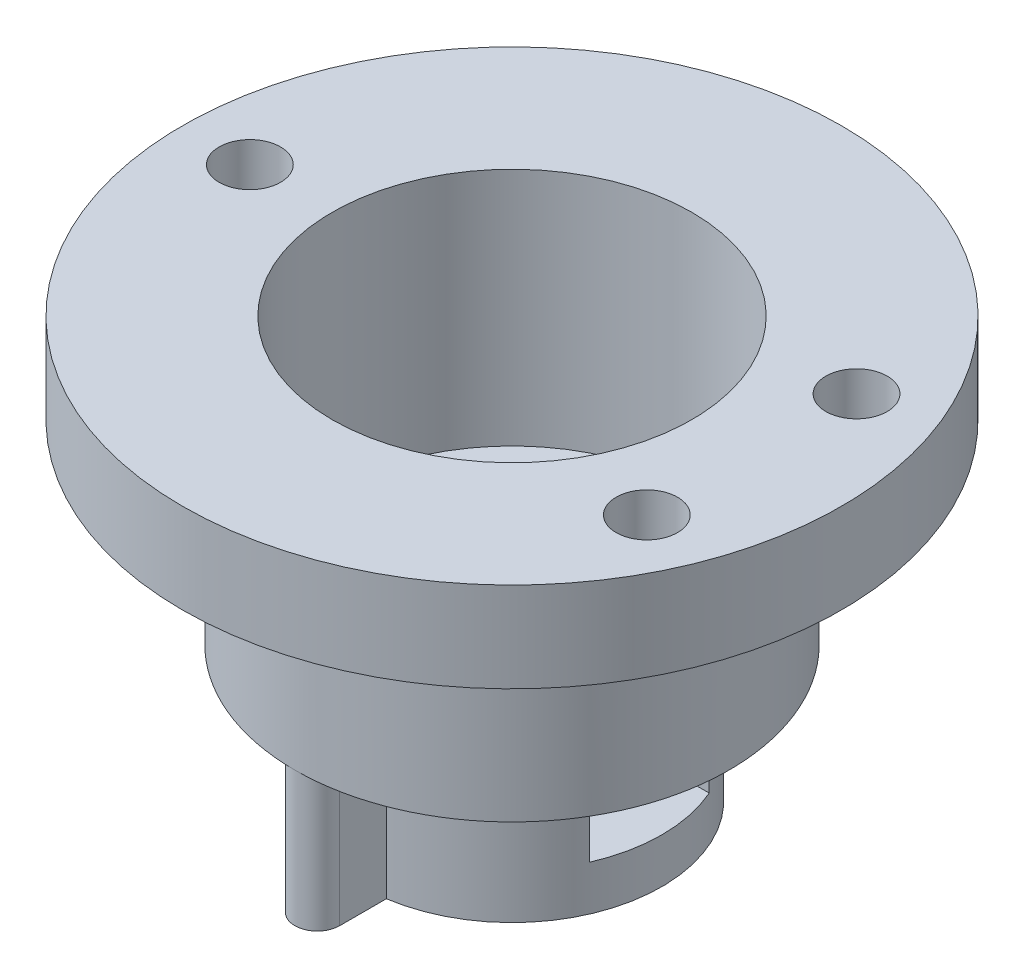
from build123d import *

# Parameters (mm, degrees)
CROQUIS5_R              = 10
SALIENTE_EXTRUIR1_DEPTH = 9
CROQUIS6_R              = 14.5
SALIENTE_EXTRUIR2_DEPTH = 13
CROQUIS7_R              = 22
SALIENTE_EXTRUIR3_DEPTH = 6
CROQUIS8_R              = 12
CORTAR_EXTRUIR1_DEPTH   = 16
CROQUIS9_R              = 3
CORTAR_EXTRUIR2_DEPTH   = 16
CROQUIS10_W             = 3
CROQUIS10_H             = 9
SALIENTE_EXTRUIR4_DEPTH = 13
SALIENTE_EXTRUIR5_DEPTH = 13
CROQUIS12_W             = 8
CROQUIS12_H             = 3.8
CORTAR_EXTRUIR3_DEPTH   = 13
CROQUIS13_R             = 3
CORTAR_EXTRUIR4_DEPTH   = 13
CROQUIS14_R             = 2.05
CORTAR_EXTRUIR5_DEPTH   = 13


with BuildPart() as part:
    # Croquis5 → Saliente-Extruir1 (new body)
    with BuildSketch(Plane(origin=(0, 0, 0), x_dir=(1, 0, 0), z_dir=(0, 1, 0))):
        with Locations(Location((0, 0, 0), (0, 0, 270))):
            Circle(CROQUIS5_R)
    extrude(amount=SALIENTE_EXTRUIR1_DEPTH)

    # Croquis6 → Saliente-Extruir2 (add)
    with BuildSketch(Plane(origin=(0, 9, 0), x_dir=(1, 0, 0), z_dir=(0, 1, 0))):
        with Locations(Location((0, 0, 0), (0, 0, 90))):
            Circle(CROQUIS6_R)
    extrude(amount=SALIENTE_EXTRUIR2_DEPTH)

    # Croquis7 → Saliente-Extruir3 (add)
    with BuildSketch(Plane(origin=(0, 22, 0), x_dir=(1, 0, 0), z_dir=(0, 1, 0))):
        with Locations(Location((0, 0, 0), (0, 0, 270))):
            Circle(CROQUIS7_R)
    extrude(amount=SALIENTE_EXTRUIR3_DEPTH)

    # Croquis8 → Cortar-Extruir1 (cut)
    with BuildSketch(Plane(origin=(0, 28, 0), x_dir=(1, 0, 0), z_dir=(0, 1, 0))):
        with Locations(Location((0, 0, 0), (0, 0, 270))):
            Circle(CROQUIS8_R)
    extrude(amount=-CORTAR_EXTRUIR1_DEPTH, mode=Mode.SUBTRACT)

    # Croquis9 → Cortar-Extruir2 (cut)
    with BuildSketch(Plane(origin=(0, 12, 0), x_dir=(1, 0, 0), z_dir=(0, 1, 0))):
        with Locations(Location((0, 0, 0), (0, 0, 270))):
            Circle(CROQUIS9_R)
    extrude(amount=-CORTAR_EXTRUIR2_DEPTH, mode=Mode.SUBTRACT)

    # Croquis10 → Saliente-Extruir4 (add)
    with BuildSketch(Plane.XY):
        with Locations((0, 4.5)):
            Rectangle(CROQUIS10_W, CROQUIS10_H)
    extrude(amount=SALIENTE_EXTRUIR4_DEPTH)

    # Croquis11 → Saliente-Extruir5 (add)
    with BuildSketch(Plane.XZ):
        with BuildLine():
            Line((-1.5, 13), (1.5, 13))
            ThreePointArc((1.5, 13), (0, 14.5), (-1.5, 13))
        make_face()
    extrude(amount=-SALIENTE_EXTRUIR5_DEPTH)

    # Croquis12 → Cortar-Extruir3 (cut)
    with BuildSketch(Plane(origin=(0, 0, 0), x_dir=(0, 0, -1), z_dir=(1, 0, 0))):
        with Locations((0, 4.9)):
            Rectangle(CROQUIS12_W, CROQUIS12_H)
    extrude(amount=CORTAR_EXTRUIR3_DEPTH, mode=Mode.SUBTRACT)

    # Croquis13 → Cortar-Extruir4 (cut)
    with BuildSketch(Plane(origin=(0, 12, 0), x_dir=(1, 0, 0), z_dir=(0, 1, 0))):
        with Locations(Location((0, 0, 0), (0, 0, 270))):
            Circle(CROQUIS13_R)
    extrude(amount=-CORTAR_EXTRUIR4_DEPTH, mode=Mode.SUBTRACT)

    # Croquis14 → Cortar-Extruir5 (cut)
    with BuildSketch(Plane(origin=(0, 28, 0), x_dir=(1, 0, 0), z_dir=(0, 1, 0))):
        with Locations(Location((-17.5, 0, 0), (0, 0, 270))):
            Circle(CROQUIS14_R)
        with Locations(Location((15.999727998, 7, 0), (0, 0, 270))):
            Circle(CROQUIS14_R)
        with Locations(Location((15.999727998, -7, 0), (0, 0, 270))):
            Circle(CROQUIS14_R)
    extrude(amount=-CORTAR_EXTRUIR5_DEPTH, mode=Mode.SUBTRACT)


solid = part.part
